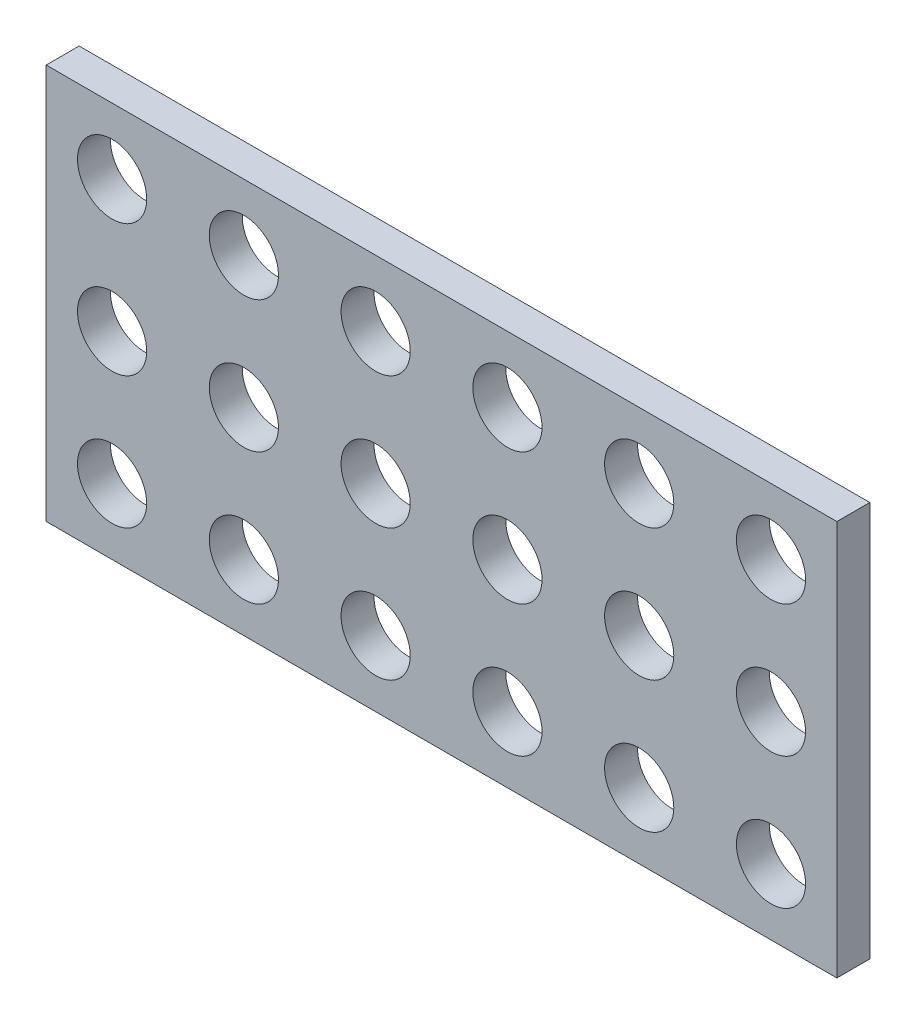
from build123d import *

# Parameters (mm, degrees)
ESQUISSE1_W                     = 48
ESQUISSE1_H                     = 24
BOSS_EXTRU_1_DEPTH              = 2
ESQUISSE2_R                     = 2.1
ENL_V_MAT_EXTRU_1_DEPTH         = 54.702886328
R_P_TITION_LIN_AIRE1_COUNT      = 3
R_P_TITION_LIN_AIRE1_PITCH      = 8
R_P_TITION_LIN_AIRE1_COUNT_DIR2 = 6
R_P_TITION_LIN_AIRE1_PITCH_DIR2 = 8


with BuildPart() as part:
    # Esquisse1 → Boss.-Extru.1 (new body)
    with BuildSketch(Plane.XY):
        with Locations((24, 12)):
            Rectangle(ESQUISSE1_W, ESQUISSE1_H)
    extrude(amount=BOSS_EXTRU_1_DEPTH)

    # Esquisse2 → Enlèv. mat.-Extru.1 (cut, through all)
    with BuildSketch(Plane.XY.offset(2)):
        with Locations((4, 20)):
            Circle(ESQUISSE2_R)
    enl_v_mat_extru_1 = extrude(amount=-ENL_V_MAT_EXTRU_1_DEPTH, mode=Mode.SUBTRACT)

    # Répétition linéaire1: Enl_v. mat.-Extru.1 3 × 6
    with Locations(*[(j * R_P_TITION_LIN_AIRE1_PITCH_DIR2, -i * R_P_TITION_LIN_AIRE1_PITCH, 0) for i in range(R_P_TITION_LIN_AIRE1_COUNT) for j in range(R_P_TITION_LIN_AIRE1_COUNT_DIR2) if (i, j) != (0, 0)]):
        add(enl_v_mat_extru_1, mode=Mode.SUBTRACT)


solid = part.part
